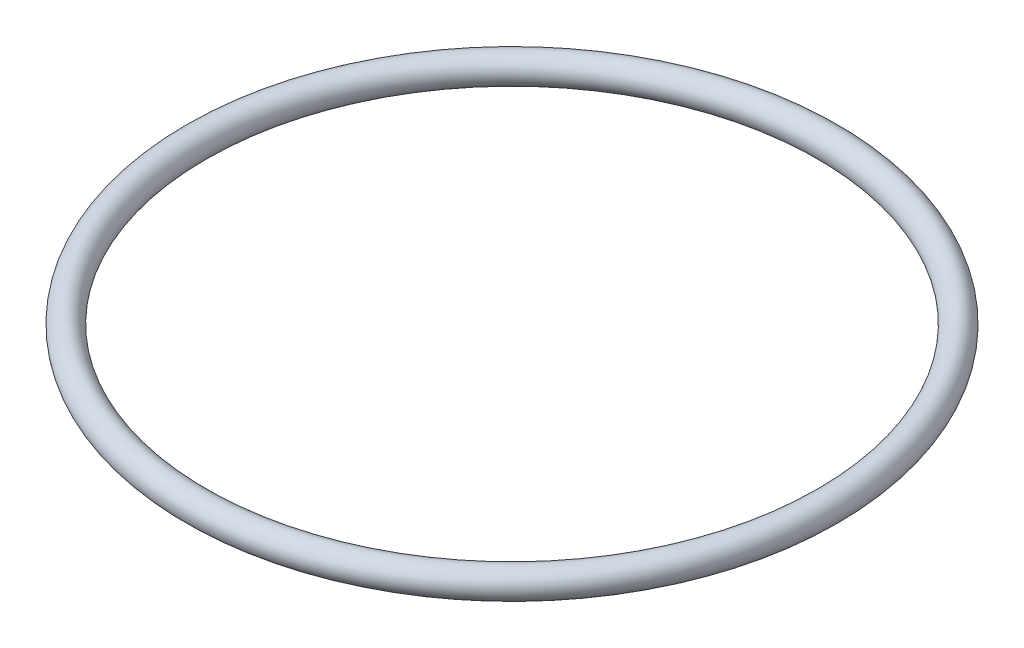
from build123d import *

# Parameters (mm, degrees)
SKETCH2_R = 3


with BuildPart() as part:
    # Sweep1: sweep along a path in Sketch1
    with BuildLine(Plane(origin=(0, 0, 0), x_dir=(1, 0, 0), z_dir=(0, 1, 0))) as sweep1_path:
        CenterArc((0, 0), 67.447846, 0, 360)
    # Sketch2 → Sweep1 (sweep)
    with BuildSketch(Plane.XY):
        with Locations((-67.447846, 0)):
            Circle(SKETCH2_R)
    sweep(path=sweep1_path.line)


solid = part.part
